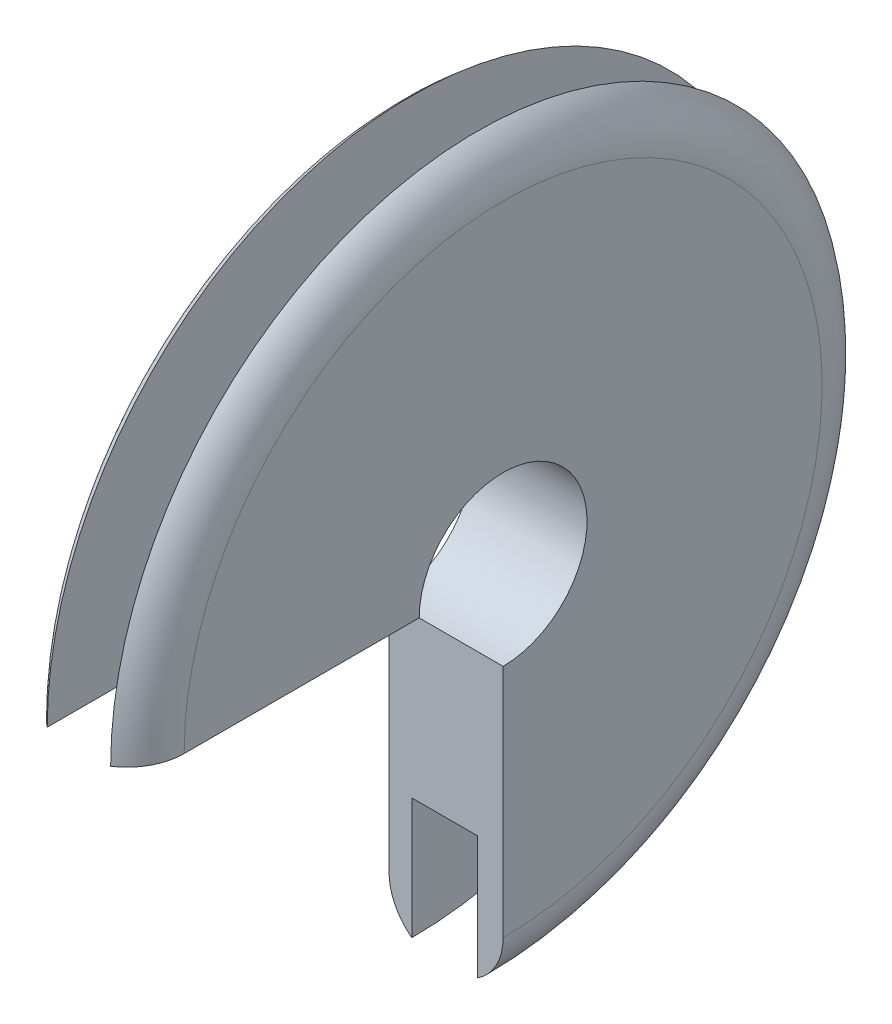
from build123d import *

# Parameters (mm, degrees)
REVOLVE1_ANGLE           = 180
REVOLVE1_OTHER_WAY_ANGLE = 90
SKETCH7_W                = 15.617438642
SKETCH7_H                = 46.497374137


with BuildPart() as part:
    # Sketch1 → Revolve1 (revolve)
    with BuildSketch(Plane(origin=(0, 0, 0), x_dir=(1, 0, 0), z_dir=(0, 1, 0))):
        with BuildLine():
            Line((-13.594162094, 76.01737396), (-13.594162094, 20))
            Line((-13.594162094, 20), (13.594162094, 20))
            Line((13.594162094, 20), (13.594162094, 76.01737396))
            ThreePointArc((13.594162094, 76.01737396), (0, 89.611536054), (-13.594162094, 76.01737396))
        make_face()
    revolve(axis=Axis((-161.278786223, 0, 0), (1, 0, 0)), revolution_arc=REVOLVE1_ANGLE)

    # Sketch1 → Revolve1 other way (revolve)
    with BuildSketch(Plane(origin=(0, 0, 0), x_dir=(1, 0, 0), z_dir=(0, 1, 0))):
        with BuildLine():
            Line((-13.594162094, 76.01737396), (-13.594162094, 20))
            Line((-13.594162094, 20), (13.594162094, 20))
            Line((13.594162094, 20), (13.594162094, 76.01737396))
            ThreePointArc((13.594162094, 76.01737396), (0, 89.611536054), (-13.594162094, 76.01737396))
        make_face()
    revolve(axis=Axis((-161.278786223, 0, 0), (-1, 0, 0)), revolution_arc=REVOLVE1_OTHER_WAY_ANGLE)

    # Sketch7 → Cut-Revolve1 (revolve, cut)
    with BuildSketch(Plane.XY):
        with Locations((-0.354941787, 81.281669295)):
            Rectangle(SKETCH7_W, SKETCH7_H)
    revolve(axis=Axis((-109.322070492, 0, 0), (1, 0, 0)), mode=Mode.SUBTRACT)


solid = part.part
